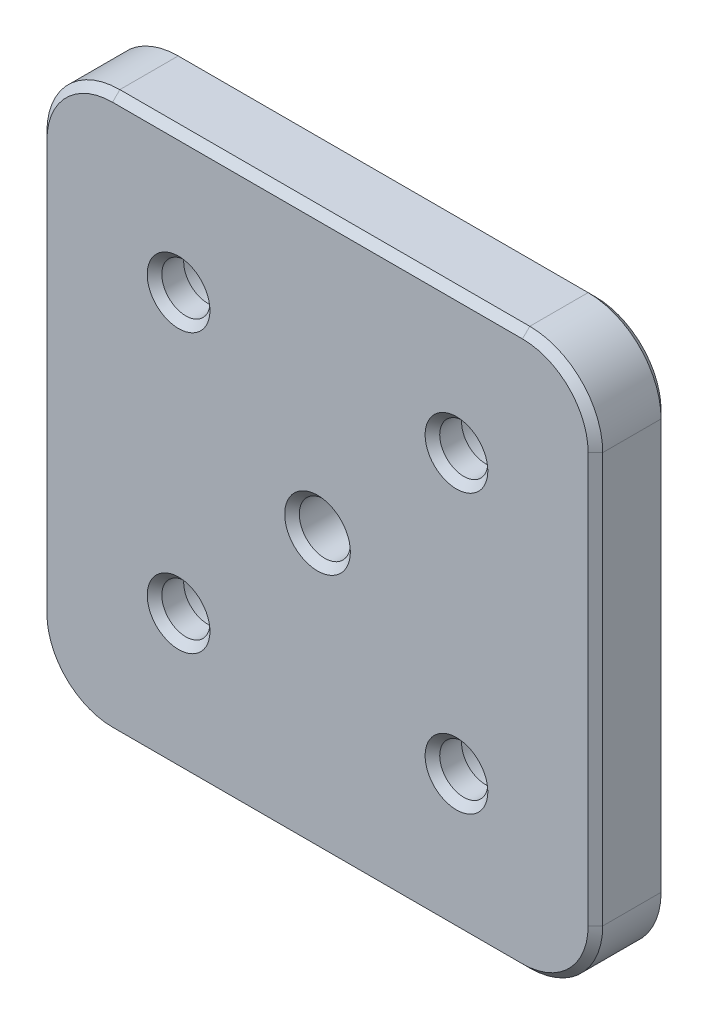
from build123d import *

# Parameters (mm, degrees)
SKETCH3_W                                     = 76.2
SKETCH3_H                                     = 76.2
BOSS_EXTRUDE3_DEPTH                           = 10
CBORE_FOR_M6_HEX_SOCKET_HEAD_CAP1_D           = 6.6
CBORE_FOR_M6_HEX_SOCKET_HEAD_CAP1_CBORE_D     = 11
CBORE_FOR_M6_HEX_SOCKET_HEAD_CAP1_CBORE_DEPTH = 6
FILLET1_R                                     = 10
SKETCH2_R                                     = 10
BOSS_EXTRUDE4_DEPTH                           = 10
SKETCH9_R                                     = 3.5
CUT_EXTRUDE1_DEPTH                            = 58.473646135
CHAMFER1_SIZE                                 = 1


with BuildPart() as part:
    # Sketch3 → Boss-Extrude3 (new body)
    with BuildSketch(Plane.XY):
        Rectangle(SKETCH3_W, SKETCH3_H)
    extrude(amount=BOSS_EXTRUDE3_DEPTH)

    # CBORE for M6 Hex Socket Head Cap1 (through all)
    with Locations(Plane(origin=(0, 0, 0), x_dir=(-1, 0, 0), z_dir=(0, 0, -1))):
        with Locations((19.05, 19.05), (19.05, -19.05), (-19.05, 19.05), (-19.05, -19.05)):
            CounterBoreHole(CBORE_FOR_M6_HEX_SOCKET_HEAD_CAP1_D / 2, CBORE_FOR_M6_HEX_SOCKET_HEAD_CAP1_CBORE_D / 2, CBORE_FOR_M6_HEX_SOCKET_HEAD_CAP1_CBORE_DEPTH)

    # Fillet1
    fillet1_edges = [part.edges().sort_by_distance(p)[0] for p in [
        (38.1, -38.1, 5),
        (-38.1, -38.1, 5),
        (-38.1, 38.1, 5),
        (38.1, 38.1, 5),
    ]]
    fillet(fillet1_edges, radius=FILLET1_R)

    # Sketch2 → Boss-Extrude4 (add)
    with BuildSketch(Plane(origin=(0, 0, 0), x_dir=(-1, 0, 0), z_dir=(0, 0, -1))):
        Circle(SKETCH2_R)
    extrude(amount=BOSS_EXTRUDE4_DEPTH)

    # Sketch9 → Cut-Extrude1 (cut, through all)
    with BuildSketch(Plane(origin=(0, 0, -10), x_dir=(-1, 0, 0), z_dir=(0, 0, -1))):
        Circle(SKETCH9_R)
    extrude(amount=-CUT_EXTRUDE1_DEPTH, mode=Mode.SUBTRACT)

    # Chamfer1
    chamfer1_edges = [part.edges().sort_by_distance(p)[0] for p in [
        (24.55, -19.05, 0),
        (15.75, -19.05, 10),
        (24.55, 19.05, 0),
        (15.75, 19.05, 10),
        (-13.55, -19.05, 0),
        (-22.35, -19.05, 10),
        (-13.55, 19.05, 0),
        (-22.35, 19.05, 10),
        (0, 38.1, 0),
        (0, 38.1, 10),
        (38.1, 0, 0),
        (0, -38.1, 0),
        (-38.1, 0, 0),
        (-35.171067812, 35.171067812, 0),
        (-35.171067812, -35.171067812, 0),
        (35.171067812, -35.171067812, 0),
        (35.171067812, 35.171067812, 0),
        (38.1, 0, 10),
        (-38.1, 0, 10),
        (0, -38.1, 10),
        (-35.171067812, 35.171067812, 10),
        (-35.171067812, -35.171067812, 10),
        (35.171067812, -35.171067812, 10),
        (35.171067812, 35.171067812, 10),
        (10, 0, -10),
        (3.5, 0, 10),
        (3.5, 0, -10),
    ]]
    chamfer(chamfer1_edges, length=CHAMFER1_SIZE)


solid = part.part
